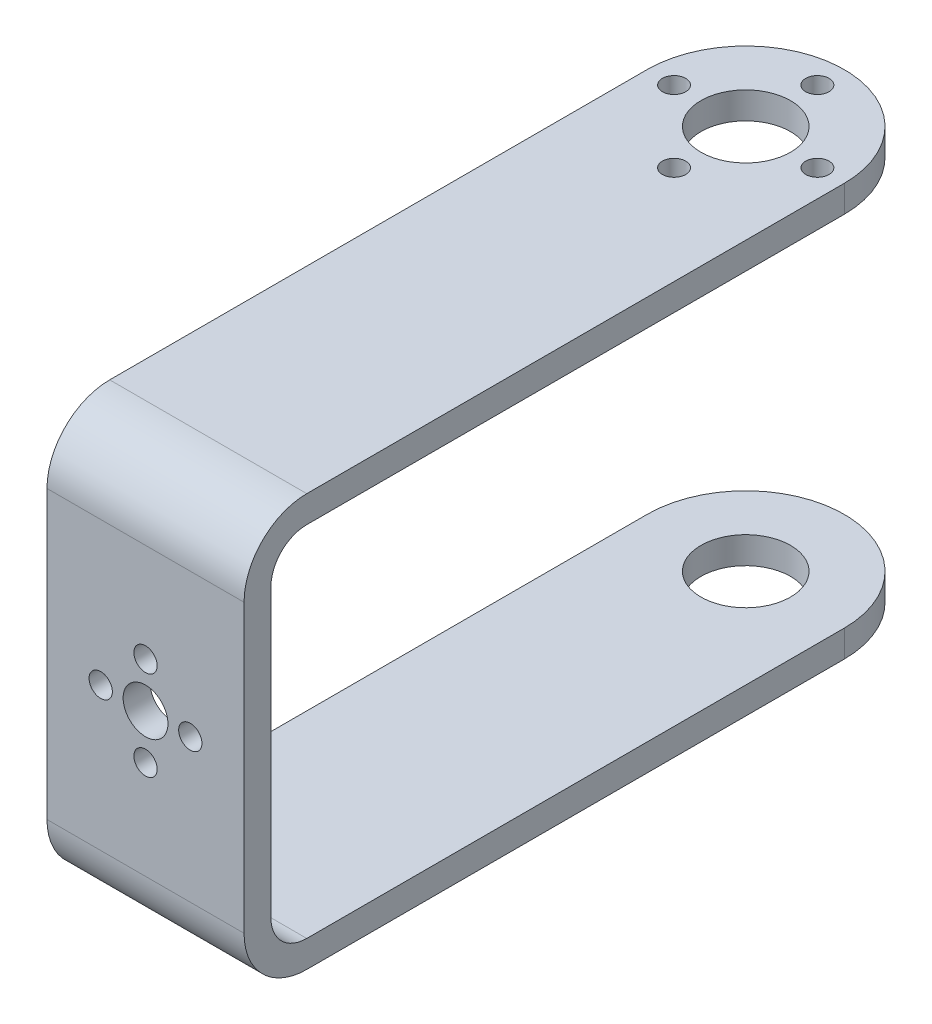
from build123d import *

# Parameters (mm, degrees)
SKETCH1_R           = 1.3
BOSS_EXTRUDE1_DEPTH = 3
SKETCH2_W           = 3
SKETCH2_H           = 32
BOSS_EXTRUDE2_DEPTH = 22
BOSS_EXTRUDE3_START = 3
BOSS_EXTRUDE3_DEPTH = 3
SKETCH7_R           = 2.5
SKETCH7_R_2         = 1.3
CUT_EXTRUDE1_DEPTH  = 3


with BuildPart() as part:
    # Sketch1 → Boss-Extrude1 (new body)
    # profile 1 of 3: a face of its own
    with BuildSketch(Plane(origin=(0, 0, 0), x_dir=(1, 0, 0), z_dir=(0, 1, 0))):
        with BuildLine():
            Line((11, -60), (11, 0))
            ThreePointArc((11, 0), (0, -11), (-11, 0))
            Line((-11, 0), (-11, -60))
            Line((-11, -60), (11, -60))
        make_face()
    # profile 2 of 3: a face of its own
    with BuildSketch(Plane(origin=(0, 0, 0), x_dir=(1, 0, 0), z_dir=(0, 1, 0))):
        with BuildLine():
            Line((11, 0), (9.3, 0))
            ThreePointArc((9.3, 0), (8, -1.3), (6.7, 0))
            Line((6.7, 0), (5, 0))
            ThreePointArc((5, 0), (0, -5), (-5, 0))
            Line((-5, 0), (-6.7, 0))
            ThreePointArc((-6.7, 0), (-8, -1.3), (-9.3, 0))
            Line((-9.3, 0), (-11, 0))
            ThreePointArc((-11, 0), (0, -11), (11, 0))
        make_face()
        with Locations(Location((0, -8, 0), (0, 0, 270))):
            Circle(SKETCH1_R, mode=Mode.SUBTRACT)
    # profile 3 of 3: a face of its own
    with BuildSketch(Plane(origin=(0, 0, 0), x_dir=(1, 0, 0), z_dir=(0, 1, 0))):
        with BuildLine():
            ThreePointArc((6.7, 0), (8, 1.3), (9.3, 0))
            Line((9.3, 0), (11, 0))
            ThreePointArc((11, 0), (0, 11), (-11, 0))
            Line((-11, 0), (-9.3, 0))
            ThreePointArc((-9.3, 0), (-8, 1.3), (-6.7, 0))
            Line((-6.7, 0), (-5, 0))
            ThreePointArc((-5, 0), (0, 5), (5, 0))
            Line((5, 0), (6.7, 0))
        make_face()
        with Locations(Location((0, 8, 0), (0, 0, 270))):
            Circle(SKETCH1_R, mode=Mode.SUBTRACT)
    extrude(amount=BOSS_EXTRUDE1_DEPTH)

    # Sketch2 → Boss-Extrude2 (add)
    with BuildSketch(Plane(origin=(11, 0, 0), x_dir=(0, 0, -1), z_dir=(1, 0, 0))):
        with Locations((-65.5, -20)):
            Rectangle(SKETCH2_W, SKETCH2_H)
        with BuildLine():
            ThreePointArc((-60, 3), (-64.949747468, 0.949747468), (-67, -4))
            Line((-67, -4), (-64, -4))
            ThreePointArc((-64, -4), (-62.828427125, -1.171572875), (-60, 0))
            Line((-60, 0), (-60, 3))
        make_face()
        with BuildLine():
            ThreePointArc((-64, -36), (-62.828427125, -38.828427125), (-60, -40))
            Line((-60, -40), (-60, -43))
            ThreePointArc((-60, -43), (-64.949747468, -40.949747468), (-67, -36))
            Line((-67, -36), (-64, -36))
        make_face()
    extrude(amount=-BOSS_EXTRUDE2_DEPTH)

    # Sketch6 → Boss-Extrude3 (add)
    with BuildSketch(Plane(origin=(0, -40, 0), x_dir=(-1, 0, 0), z_dir=(0, -1, 0)).offset(BOSS_EXTRUDE3_START)):
        with BuildLine():
            Line((11, -60), (11, 0))
            ThreePointArc((11, 0), (0, -11), (-11, 0))
            Line((-11, 0), (-11, -60))
            Line((-11, -60), (11, -60))
        make_face()
        with BuildLine():
            ThreePointArc((-5, 0), (0, 5), (5, 0))
            Line((5, 0), (11, 0))
            ThreePointArc((11, 0), (0, 11), (-11, 0))
            Line((-11, 0), (-5, 0))
        make_face()
        with BuildLine():
            Line((11, 0), (5, 0))
            ThreePointArc((5, 0), (0, -5), (-5, 0))
            Line((-5, 0), (-11, 0))
            ThreePointArc((-11, 0), (0, -11), (11, 0))
        make_face()
    extrude(amount=-BOSS_EXTRUDE3_DEPTH)

    # Sketch7 → Cut-Extrude1 (cut)
    with BuildSketch(Plane.XY.offset(67)):
        with Locations((0, -20)):
            Circle(SKETCH7_R)
        with Locations((5, -20)):
            Circle(SKETCH7_R_2)
        with Locations((-5, -20)):
            Circle(SKETCH7_R_2)
        with Locations((0, -25)):
            Circle(SKETCH7_R_2)
        with Locations((0, -15)):
            Circle(SKETCH7_R_2)
    extrude(amount=-CUT_EXTRUDE1_DEPTH, mode=Mode.SUBTRACT)


solid = part.part
